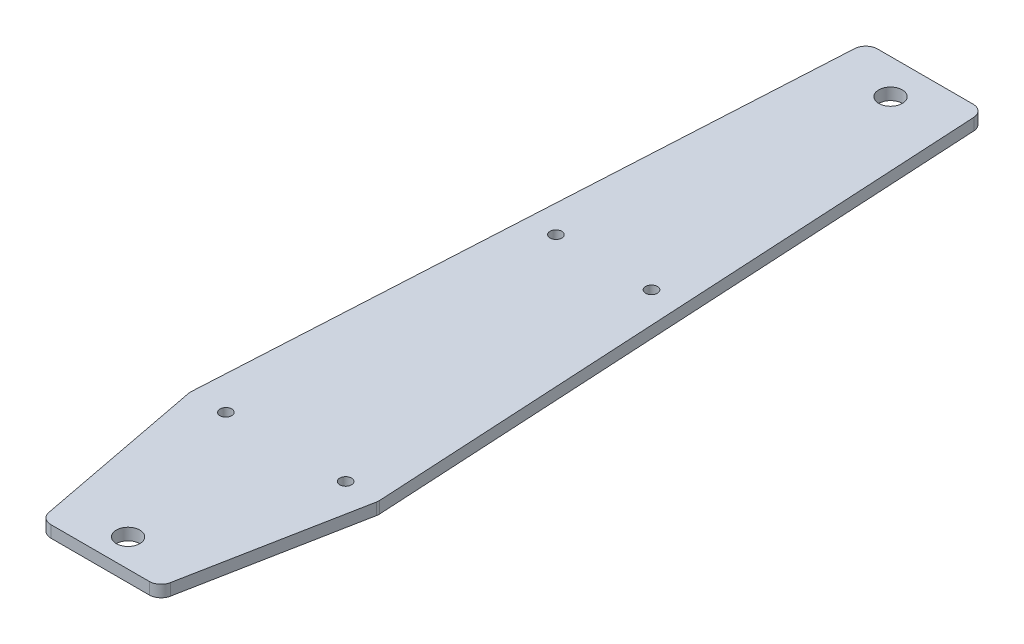
from build123d import *

# Parameters (mm, degrees)
SKETCH1_R           = 2.5
SKETCH1_R_2         = 5
BOSS_EXTRUDE1_DEPTH = 5


with BuildPart() as part:
    # Sketch1 → Boss-Extrude1 (new body)
    with BuildSketch(Plane(origin=(0, 0, 0), x_dir=(1, 0, 0), z_dir=(0, 1, 0))):
        with BuildLine():
            Line((4.130127217, 0), (45.869872783, 0))
            ThreePointArc((45.869872783, 0), (49.054139071, 1.145074812), (50.779916111, 4.055820718))
            Line((50.779916111, 4.055820718), (64.883723024, 77.400263156))
            ThreePointArc((64.883723024, 77.400263156), (64.962312899, 78.007487301), (64.966093723, 78.619764391))
            Line((64.966093723, 78.619764391), (50.260556832, 345.275321952))
            ThreePointArc((50.260556832, 345.275321952), (48.704957481, 348.63157058), (45.268142804, 350))
            Line((45.268142804, 350), (4.731857196, 350))
            ThreePointArc((4.731857196, 350), (1.295042519, 348.63157058), (-0.260556832, 345.275321952))
            Line((-0.260556832, 345.275321952), (-14.966093723, 78.619764391))
            ThreePointArc((-14.966093723, 78.619764391), (-14.962312899, 78.007487301), (-14.883723024, 77.400263156))
            Line((-14.883723024, 77.400263156), (-0.779916111, 4.055820718))
            ThreePointArc((-0.779916111, 4.055820718), (0.945860929, 1.145074812), (4.130127217, 0))
        make_face()
        with Locations(Location((50.779916111, 78.344442439, 0), (0, 0, 270))):
            Circle(SKETCH1_R, mode=Mode.SUBTRACT)
        with Locations(Location((0, 78.344442439, 0), (0, 0, 270))):
            Circle(SKETCH1_R, mode=Mode.SUBTRACT)
        with Locations(Location((25, 11.876781334, 0), (0, 0, 270))):
            Circle(SKETCH1_R_2, mode=Mode.SUBTRACT)
        with Locations(Location((45.268142804, 213.58952196, 0), (0, 0, 270))):
            Circle(SKETCH1_R, mode=Mode.SUBTRACT)
        with Locations(Location((4.731857196, 213.58952196, 0), (0, 0, 270))):
            Circle(SKETCH1_R, mode=Mode.SUBTRACT)
        with Locations(Location((25, 335.239262598, 0), (0, 0, 270))):
            Circle(SKETCH1_R_2, mode=Mode.SUBTRACT)
    extrude(amount=BOSS_EXTRUDE1_DEPTH)


solid = part.part
